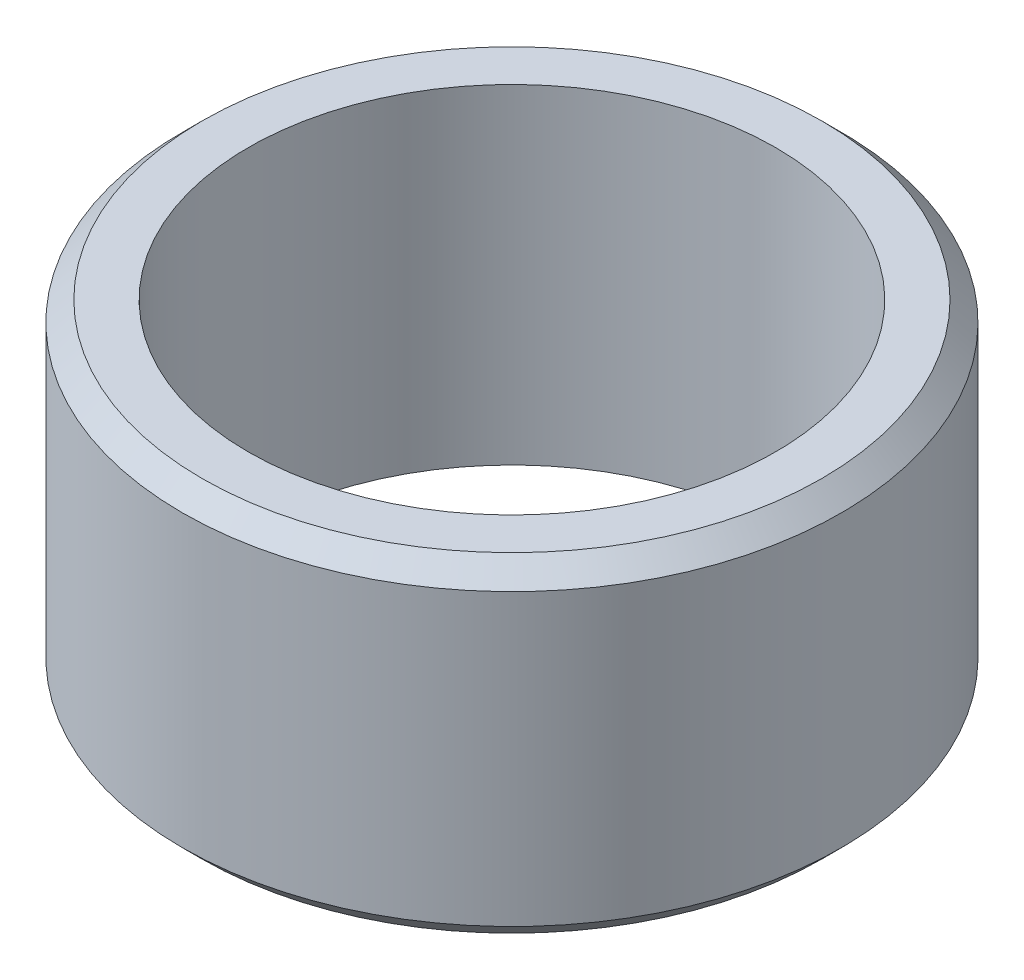
from build123d import *

# Parameters (mm, degrees)
SKETCH1_R           = 5
SKETCH1_R_2         = 4
BOSS_EXTRUDE2_DEPTH = 5
CHAMFER1_SIZE       = 0.3


with BuildPart() as part:
    # Sketch1 → Boss-Extrude2 (new body)
    with BuildSketch(Plane(origin=(0, 0, 0), x_dir=(1, 0, 0), z_dir=(0, 1, 0))):
        with Locations(Location((0, 0, 0), (0, 0, 270))):
            Circle(SKETCH1_R)
        with Locations(Location((0, 0, 0), (0, 0, 270))):
            Circle(SKETCH1_R_2, mode=Mode.SUBTRACT)
    extrude(amount=BOSS_EXTRUDE2_DEPTH)

    # Chamfer1
    chamfer1_edges = [part.edges().sort_by_distance(p)[0] for p in [
        (0, 0, -5),
        (0, 5, -5),
    ]]
    chamfer(chamfer1_edges, length=CHAMFER1_SIZE)


solid = part.part
